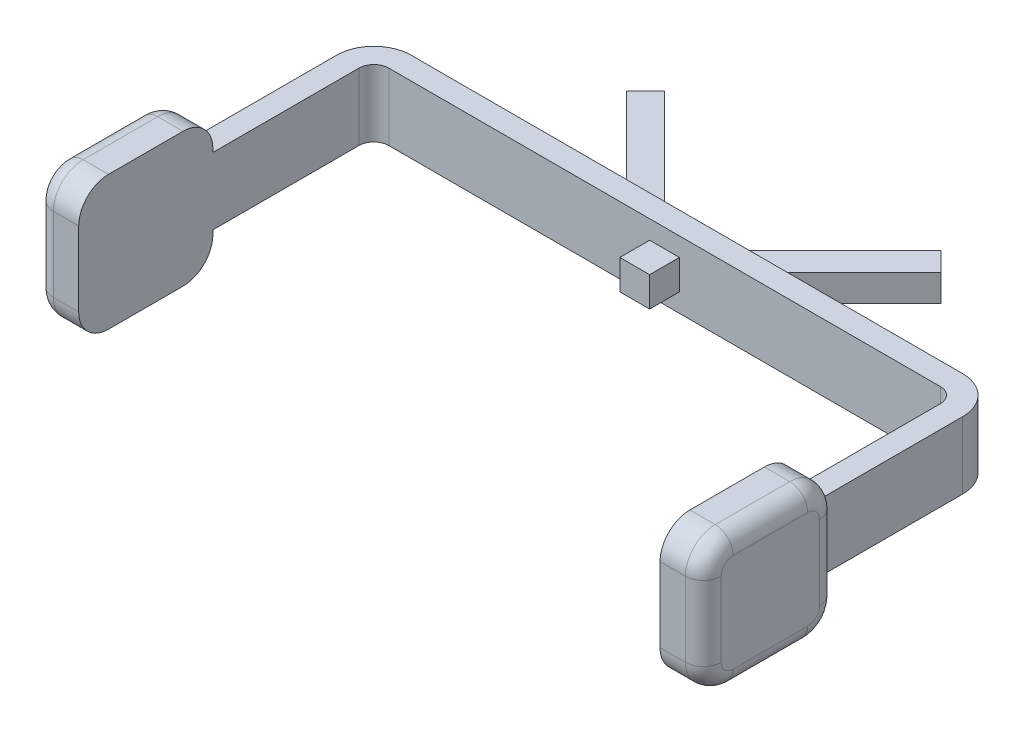
from build123d import *

# Parameters (mm, degrees)
EXTRUDE_2_DEPTH        = 2.25
SKETCH_1_5_W           = 2
SKETCH_1_5_H           = 2
EXTRUDE_3_DEPTH        = 1
EXTRUDE_4_DEPTH        = 0.9
EXTRUDE_5_DEPTH        = 2.9
FILLET_1_R             = 1.2
FILLET_1_OF_MIRROR_2_R = 1.2


with BuildPart() as part:
    # 草图1 → 凸台-拉伸2 (new, symmetric)
    with BuildSketch(Plane(origin=(0, 0, 0), x_dir=(1, 0, 0), z_dir=(0, 1, 0))):
        with BuildLine():
            Line((-18.5, -1.5), (18.5, -1.5))
            ThreePointArc((18.5, -1.5), (19.207106781, -1.792893219), (19.5, -2.5))
            Line((19.5, -2.5), (19.5, -12.3))
            Line((19.5, -12.3), (21, -12.3))
            Line((21, -12.3), (21, -2.5))
            ThreePointArc((21, -2.5), (20.267766953, -0.732233047), (18.5, 0))
            Line((18.5, 0), (-18.5, 0))
            ThreePointArc((-18.5, 0), (-20.267766953, -0.732233047), (-21, -2.5))
            Line((-21, -2.5), (-21, -12.3))
            Line((-21, -12.3), (-19.5, -12.3))
            Line((-19.5, -12.3), (-19.5, -2.5))
            ThreePointArc((-19.5, -2.5), (-19.207106781, -1.792893219), (-18.5, -1.5))
        make_face()
    extrude(amount=EXTRUDE_2_DEPTH, both=True)

    # 草图1<5> → 凸台-拉伸3 (add, symmetric)
    with BuildSketch(Plane(origin=(0, 0, 0), x_dir=(1, 0, 0), z_dir=(0, 1, 0))):
        with Locations((0, -2.5)):
            Rectangle(SKETCH_1_5_W, SKETCH_1_5_H)
    extrude(amount=EXTRUDE_3_DEPTH, both=True)

    # 草图1<6> → 凸台-拉伸4 (add, symmetric)
    with BuildSketch(Plane(origin=(0, 0, 0), x_dir=(1, 0, 0), z_dir=(0, 1, 0))):
        Polygon((-4.045584412, 0), (-1.5, 0), (-9.278174593, 7.778174593), (-10.550966799, 6.505382387), align=None)
        Polygon((9.278174593, 7.778174593), (1.5, 0), (4.045584412, 0), (10.550966799, 6.505382387), align=None)
    extrude(amount=EXTRUDE_4_DEPTH, both=True)

    # 草图2 → 凸台-拉伸5 (add)
    with BuildSketch(Plane.ZY.offset(-19.5)):
        with BuildLine():
            Line((19.3, 4.478921871), (14.3, 4.478921871))
            ThreePointArc((14.3, 4.478921871), (12.885786438, 3.893135433), (12.3, 2.478921871))
            Line((12.3, 2.478921871), (12.3, -2.521078129))
            ThreePointArc((12.3, -2.521078129), (12.885786438, -3.935291691), (14.3, -4.521078129))
            Line((14.3, -4.521078129), (19.3, -4.521078129))
            ThreePointArc((19.3, -4.521078129), (20.714213562, -3.935291691), (21.3, -2.521078129))
            Line((21.3, -2.521078129), (21.3, 2.478921871))
            ThreePointArc((21.3, 2.478921871), (20.714213562, 3.893135433), (19.3, 4.478921871))
        make_face()
    extrude_5 = extrude(amount=-EXTRUDE_5_DEPTH)

    # 圆角1
    fillet_1_edges = [part.edges().sort_by_distance(p)[0] for p in [
        (22.4, -0.021078129, 12.3),
        (22.4, -3.935291691, 12.885786438),
        (22.4, -4.521078129, 16.8),
        (22.4, -3.935291691, 20.714213562),
        (22.4, -0.021078129, 21.3),
        (22.4, 3.893135433, 20.714213562),
        (22.4, 4.478921871, 16.8),
        (22.4, 3.893135433, 12.885786438),
    ]]
    fillet(fillet_1_edges, radius=FILLET_1_R)

    # 镜向2: 凸台-拉伸5 across plane
    add(extrude_5.mirror(Plane(origin=(0, 0, 0), x_dir=(0, 0, 1), z_dir=(1, 0, 0))))

    # 圆角1 of 镜向2
    fillet_1_of_mirror_2_edges = [part.edges().sort_by_distance(p)[0] for p in [
        (-22.4, -0.021078129, 12.3),
        (-22.4, -3.935291691, 12.885786438),
        (-22.4, -4.521078129, 16.8),
        (-22.4, -3.935291691, 20.714213562),
        (-22.4, -0.021078129, 21.3),
        (-22.4, 3.893135433, 20.714213562),
        (-22.4, 4.478921871, 16.8),
        (-22.4, 3.893135433, 12.885786438),
    ]]
    fillet(fillet_1_of_mirror_2_edges, radius=FILLET_1_OF_MIRROR_2_R)


solid = part.part
